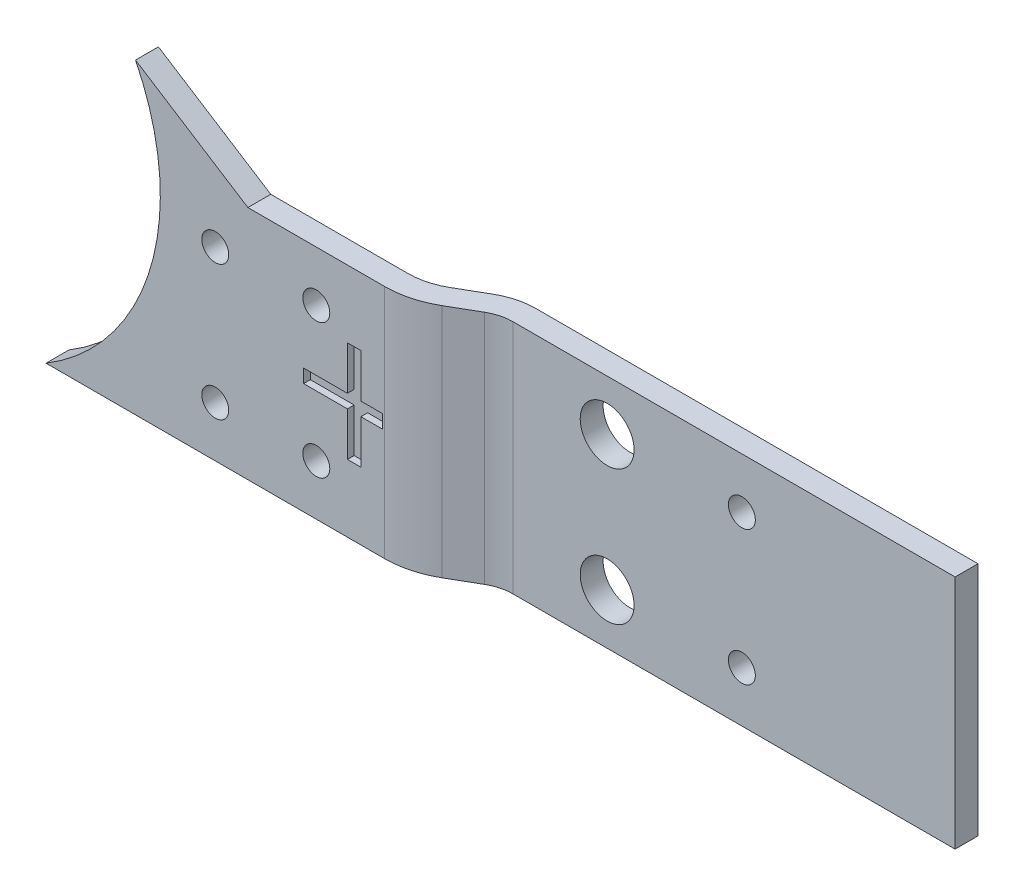
from build123d import *

# Parameters (mm, degrees)
BOSS_EXTRUDE1_DEPTH = 3.4
SKETCH3_R           = 5
CUT_EXTRUDE1_DEPTH  = 6
CUT_EXTRUDE2_DEPTH  = 10
SKETCH6_R           = 35
CUT_EXTRUDE3_DEPTH  = 10
CUT_EXTRUDE4_DEPTH  = 1
CUT_EXTRUDE5_REACH  = 87.508
SKETCH8_W           = 12
SKETCH8_H           = 35
BOSS_EXTRUDE2_DEPTH = 35
SKETCH10_R          = 4
CUT_EXTRUDE6_DEPTH  = 10
CUT_EXTRUDE7_REACH  = 153.093
SKETCH11_R          = 2
CUT_EXTRUDE8_REACH  = 153.243
SKETCH12_R          = 2


with BuildPart() as part:
    # Sketch1 → Boss-Extrude1 (new body)
    with BuildSketch(Plane.XY):
        with BuildLine():
            Line((0, -30), (80, -30))
            Line((80, -30), (80, 5))
            Line((80, 5), (48, 5))
            Line((48, 5), (16.114075804, 25.304872277))
            ThreePointArc((16.114075804, 25.304872277), (-28.802310396, 8.392074585), (0, -30))
        make_face()
    extrude(amount=BOSS_EXTRUDE1_DEPTH)

    # Sketch3 → Cut-Extrude1 (cut)
    with BuildSketch(Plane.XY.offset(3.4)):
        Circle(SKETCH3_R)
    extrude(amount=-CUT_EXTRUDE1_DEPTH, mode=Mode.SUBTRACT)

    # Sketch5 → Cut-Extrude2 (cut)
    with BuildSketch(Plane.XY.offset(3.4)):
        with BuildLine():
            ThreePointArc((0, 10), (-8.660254038, 5), (-8.660254038, -5))
            ThreePointArc((-8.660254038, -5), (-10.124355653, -10.464101615), (-15.588457268, -9))
            ThreePointArc((-15.588457268, -9), (-15.588457268, 9), (0, 18))
            ThreePointArc((0, 18), (4, 14), (0, 10))
        make_face()
    extrude(amount=-CUT_EXTRUDE2_DEPTH, mode=Mode.SUBTRACT)

    # Sketch6 → Cut-Extrude3 (cut)
    with BuildSketch(Plane(origin=(0, 0, 0), x_dir=(-1, 0, 0), z_dir=(0, 0, -1))):
        Circle(SKETCH6_R)
    extrude(amount=-CUT_EXTRUDE3_DEPTH, mode=Mode.SUBTRACT)

    # Sketch7 → Cut-Extrude4 (cut)
    with BuildSketch(Plane.XY.offset(3.4)):
        Polygon((62.77538264, -13.5), (62.77538264, -20), (64.77538264, -20), (64.77538264, -13.5), (71.27538264, -13.5), (71.27538264, -11.5), (64.77538264, -11.5), (64.77538264, -5), (62.77538264, -5), (62.77538264, -11.5), (56.27538264, -11.5), (56.27538264, -13.5), align=None)
    extrude(amount=-CUT_EXTRUDE4_DEPTH, mode=Mode.SUBTRACT)

    # Sketch8 → Cut-Extrude5 (cut, up to next)
    with BuildSketch(Plane(origin=(0, 0, 0), x_dir=(-1, 0, 0), z_dir=(0, 0, -1)), mode=Mode.PRIVATE) as cut_extrude5_sk1:
        with Locations((-74, -12.5)):
            Rectangle(SKETCH8_W, SKETCH8_H)
    cut_extrude5_tool1 = extrude(cut_extrude5_sk1.sketch, amount=-CUT_EXTRUDE5_REACH, mode=Mode.PRIVATE) & part.part
    add(cut_extrude5_tool1.solids().sort_by_distance((74, -12.5, 0))[0], mode=Mode.SUBTRACT)

    # Sketch9 → Boss-Extrude2 (add)
    with BuildSketch(Plane(origin=(0, 5, 0), x_dir=(1, 0, 0), z_dir=(0, 1, 0))):
        with BuildLine():
            Line((68, 0), (68.320508076, 0))
            ThreePointArc((68.320508076, 0), (70.908698527, 0.340741737), (73.320508076, 1.339745962))
            Line((73.320508076, 1.339745962), (77.339745962, 3.660254038))
            ThreePointArc((77.339745962, 3.660254038), (79.751555511, 4.659258263), (82.339745962, 5))
            Line((82.339745962, 5), (83, 5))
            Line((83, 5), (148, 5))
            Line((148, 5), (148, 1.6))
            Line((148, 1.6), (83, 1.6))
            Line((83, 1.6), (82.339745962, 1.6))
            ThreePointArc((82.339745962, 1.6), (80.631540264, 1.375110454), (79.039745962, 0.715767665))
            Line((79.039745962, 0.715767665), (75.020508076, -1.604740411))
            ThreePointArc((75.020508076, -1.604740411), (71.78868328, -2.943406072), (68.320508076, -3.4))
            Line((68.320508076, -3.4), (68, -3.4))
            Line((68, -3.4), (68, 0))
        make_face()
    extrude(amount=-BOSS_EXTRUDE2_DEPTH)

    # Sketch10 → Cut-Extrude6 (cut)
    with BuildSketch(Plane(origin=(0, 0, -5), x_dir=(-1, 0, 0), z_dir=(0, 0, -1))):
        with Locations((-96.339745962, -2.5)):
            Circle(SKETCH10_R)
        with Locations(Location((-96.339745962, -22.5, 0), (0, 0, 180))):
            Circle(SKETCH10_R)
    extrude(amount=-CUT_EXTRUDE6_DEPTH, mode=Mode.SUBTRACT)

    # Sketch11 → Cut-Extrude7 (cut, up to next)
    with BuildSketch(Plane(origin=(0, 0, 0), x_dir=(-1, 0, 0), z_dir=(0, 0, -1)), mode=Mode.PRIVATE) as cut_extrude7_sk1:
        with Locations((-58.160254038, -22.5)):
            Circle(SKETCH11_R)
    cut_extrude7_tool1 = extrude(cut_extrude7_sk1.sketch, amount=-CUT_EXTRUDE7_REACH, mode=Mode.PRIVATE) & part.part
    # Sketch11 → Cut-Extrude7 (cut, up to next)
    with BuildSketch(Plane(origin=(0, 0, 0), x_dir=(-1, 0, 0), z_dir=(0, 0, -1)), mode=Mode.PRIVATE) as cut_extrude7_sk2:
        with Locations((-58.160254038, -2.5)):
            Circle(SKETCH11_R)
    cut_extrude7_tool2 = extrude(cut_extrude7_sk2.sketch, amount=-CUT_EXTRUDE7_REACH, mode=Mode.PRIVATE) & part.part
    # Sketch11 → Cut-Extrude7 (cut, up to next)
    with BuildSketch(Plane(origin=(0, 0, 0), x_dir=(-1, 0, 0), z_dir=(0, 0, -1)), mode=Mode.PRIVATE) as cut_extrude7_sk3:
        with Locations((-43.160254038, -22.5)):
            Circle(SKETCH11_R)
    cut_extrude7_tool3 = extrude(cut_extrude7_sk3.sketch, amount=-CUT_EXTRUDE7_REACH, mode=Mode.PRIVATE) & part.part
    # Sketch11 → Cut-Extrude7 (cut, up to next)
    with BuildSketch(Plane(origin=(0, 0, 0), x_dir=(-1, 0, 0), z_dir=(0, 0, -1)), mode=Mode.PRIVATE) as cut_extrude7_sk4:
        with Locations((-43.160254038, -2.5)):
            Circle(SKETCH11_R)
    cut_extrude7_tool4 = extrude(cut_extrude7_sk4.sketch, amount=-CUT_EXTRUDE7_REACH, mode=Mode.PRIVATE) & part.part
    add(cut_extrude7_tool1.solids().sort_by_distance((58.160254, -22.5, 0))[0], mode=Mode.SUBTRACT)
    add(cut_extrude7_tool2.solids().sort_by_distance((58.160254, -2.5, 0))[0], mode=Mode.SUBTRACT)
    add(cut_extrude7_tool3.solids().sort_by_distance((43.160254, -22.5, 0))[0], mode=Mode.SUBTRACT)
    add(cut_extrude7_tool4.solids().sort_by_distance((43.160254, -2.5, 0))[0], mode=Mode.SUBTRACT)

    # Sketch12 → Cut-Extrude8 (cut, up to next)
    with BuildSketch(Plane(origin=(0, 0, -5), x_dir=(-1, 0, 0), z_dir=(0, 0, -1)), mode=Mode.PRIVATE) as cut_extrude8_sk1:
        with Locations((-116.339745962, -22.5)):
            Circle(SKETCH12_R)
    cut_extrude8_tool1 = extrude(cut_extrude8_sk1.sketch, amount=-CUT_EXTRUDE8_REACH, mode=Mode.PRIVATE) & part.part
    # Sketch12 → Cut-Extrude8 (cut, up to next)
    with BuildSketch(Plane(origin=(0, 0, -5), x_dir=(-1, 0, 0), z_dir=(0, 0, -1)), mode=Mode.PRIVATE) as cut_extrude8_sk2:
        with Locations((-116.339745962, -2.5)):
            Circle(SKETCH12_R)
    cut_extrude8_tool2 = extrude(cut_extrude8_sk2.sketch, amount=-CUT_EXTRUDE8_REACH, mode=Mode.PRIVATE) & part.part
    add(cut_extrude8_tool1.solids().sort_by_distance((116.339746, -22.5, -5))[0], mode=Mode.SUBTRACT)
    add(cut_extrude8_tool2.solids().sort_by_distance((116.339746, -2.5, -5))[0], mode=Mode.SUBTRACT)


solid = part.part
